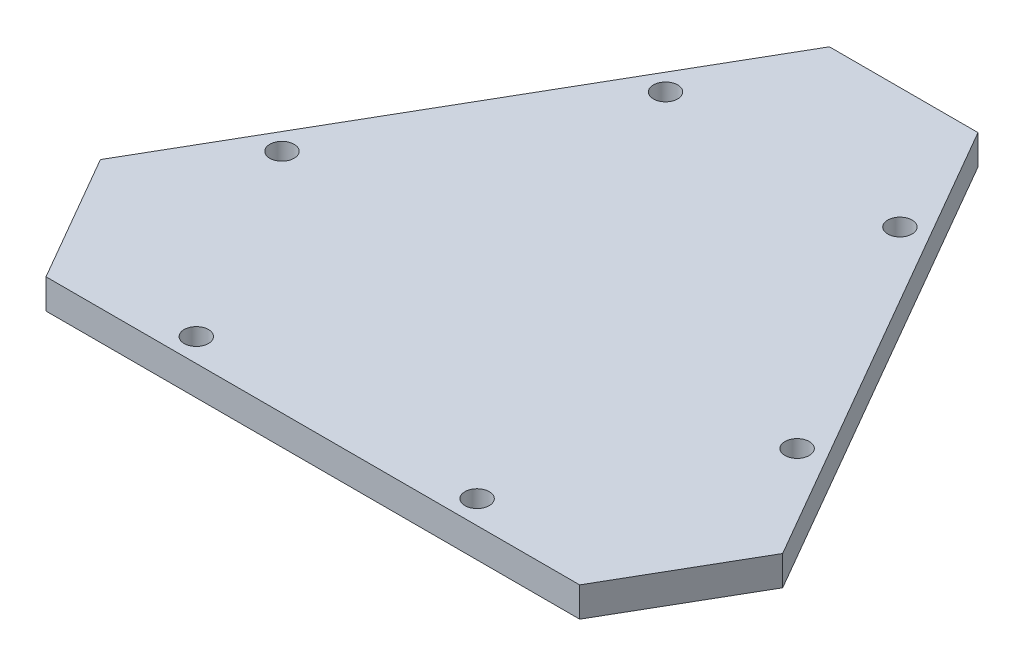
from build123d import *

# Parameters (mm, degrees)
BOSS_EXTRUDE1_DEPTH = 6.35
SKETCH9_R           = 2.6
CUT_EXTRUDE1_DEPTH  = 105.776848123


with BuildPart() as part:
    # Sketch1 → Boss-Extrude1 (new body)
    with BuildSketch(Plane(origin=(0, 0, 0), x_dir=(1, 0, 0), z_dir=(0, 1, 0))):
        Polygon((-15.875, 75), (15.875, 75), (72.889405284, -23.751846715), (57.014405284, -51.248153285), (-57.014405284, -51.248153285), (-72.889405284, -23.751846715), align=None)
    extrude(amount=BOSS_EXTRUDE1_DEPTH)

    # Sketch9 → Cut-Extrude1 (cut, through all)
    with BuildSketch(Plane(origin=(0, 6.35, 0), x_dir=(1, 0, 0), z_dir=(0, 1, 0))):
        with Locations(Location((-25.030312278, 49.142819263, 0), (0, 0, 270))):
            Circle(SKETCH9_R)
        with Locations(Location((25.008570083, 49.180192562, 0), (0, 0, 270))):
            Circle(SKETCH9_R)
        with Locations(Location((55.008731986, -2.78123819, 0), (0, 0, 270))):
            Circle(SKETCH9_R)
        with Locations(Location((30.09884337, -46.248153285, 0), (0, 0, 270))):
            Circle(SKETCH9_R)
        with Locations(Location((-55.030188745, -2.818776286, 0), (0, 0, 270))):
            Circle(SKETCH9_R)
        with Locations(Location((-29.90115663, -46.248153285, 0), (0, 0, 270))):
            Circle(SKETCH9_R)
    extrude(amount=-CUT_EXTRUDE1_DEPTH, mode=Mode.SUBTRACT)


solid = part.part
